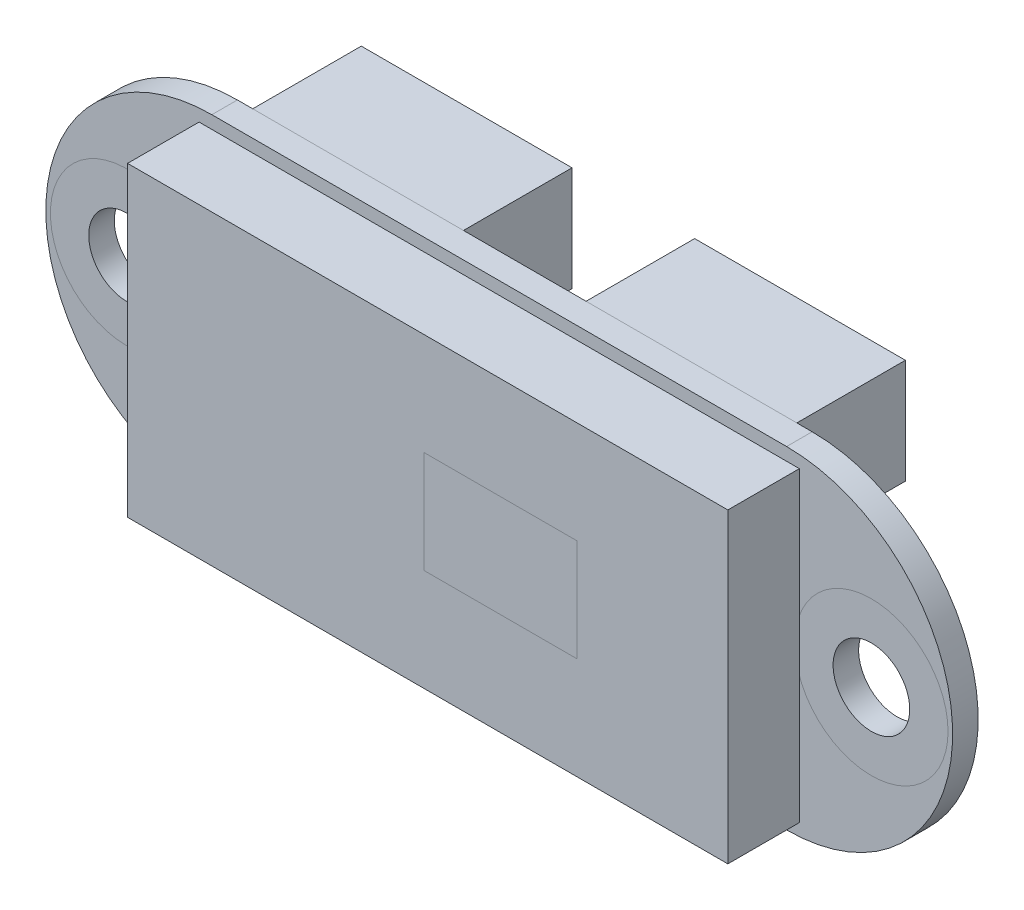
from build123d import *

# Parameters (mm, degrees)
SKETCH_1_R        = 3
EXTRUDE_1_DEPTH   = 1
SKETCH_2_R        = 3
SKETCH_2_R_2      = 1.5
EXTRUDE_2_DEPTH   = 1
EXTRUDE_2_2_DEPTH = 1
SKETCH_3_W        = 23.5
SKETCH_3_H        = 12
SKETCH_3_W_2      = 6
SKETCH_3_H_2      = 4
EXTRUDE_3_DEPTH   = 2.8
SKETCH_4_W        = 6
SKETCH_4_H        = 4
EXTRUDE_4_DEPTH   = 2.8
SKETCH_5_W        = 8.25
SKETCH_5_H        = 4.1
EXTRUDE_5_DEPTH   = 4.25
EXTRUDE_5_2_DEPTH = 4.25


with BuildPart() as part:
    # 草图1 → 凸台-拉伸1 (new body)
    with BuildSketch(Plane.XY):
        with BuildLine():
            Line((-49.510803888, 21.866656957), (-27.010803888, 21.866656957))
            ThreePointArc((-27.010803888, 21.866656957), (-20.510803888, 15.366656957), (-27.010803888, 8.866656957))
            Line((-27.010803888, 8.866656957), (-49.510803888, 8.866656957))
            ThreePointArc((-49.510803888, 8.866656957), (-56.010803888, 15.366656957), (-49.510803888, 21.866656957))
        make_face()
        with Locations((-52.830803888, 15.366656957)):
            Circle(SKETCH_1_R, mode=Mode.SUBTRACT)
        with Locations((-23.690803888, 15.366656957)):
            Circle(SKETCH_1_R, mode=Mode.SUBTRACT)
    extrude(amount=EXTRUDE_1_DEPTH)


with BuildPart() as body_2:
    # 草图2 → 凸台-拉伸2 (new body)
    with BuildSketch(Plane.XY.offset(1)):
        with Locations((-23.690803888, 15.366656957)):
            Circle(SKETCH_2_R)
        with Locations((-23.690803888, 15.366656957)):
            Circle(SKETCH_2_R_2, mode=Mode.SUBTRACT)
    extrude(amount=-EXTRUDE_2_DEPTH)


with BuildPart() as body_3:
    # 草图2 → Extrude 2 2 (new body)
    with BuildSketch(Plane.XY.offset(1)):
        with Locations((-52.830803888, 15.366656957)):
            Circle(SKETCH_2_R)
        with Locations((-52.830803888, 15.366656957)):
            Circle(SKETCH_2_R_2, mode=Mode.SUBTRACT)
    extrude(amount=-EXTRUDE_2_2_DEPTH)


with BuildPart() as body_4:
    # 草图3 → 凸台-拉伸3 (new body)
    with BuildSketch(Plane.XY.offset(1)):
        with Locations((-38.260803888, 15.366656957)):
            Rectangle(SKETCH_3_W, SKETCH_3_H)
        with Locations((-35.410803888, 15.366656957)):
            Rectangle(SKETCH_3_W_2, SKETCH_3_H_2, mode=Mode.SUBTRACT)
    extrude(amount=EXTRUDE_3_DEPTH)


with BuildPart() as body_5:
    # 草图4 → 凸台-拉伸4 (new body)
    with BuildSketch(Plane.XY.offset(3.8)):
        with Locations((-35.410803888, 15.366656957)):
            Rectangle(SKETCH_4_W, SKETCH_4_H)
    extrude(amount=-EXTRUDE_4_DEPTH)


with BuildPart() as body_6:
    # 草图5 → 凸台-拉伸5 (new body)
    with BuildSketch(Plane(origin=(0, 0, 0), x_dir=(-1, 0, 0), z_dir=(0, 0, -1))):
        with Locations((31.735803888, 19.816656957)):
            Rectangle(SKETCH_5_W, SKETCH_5_H)
    extrude(amount=EXTRUDE_5_DEPTH)


with BuildPart() as body_7:
    # 草图5 → Extrude 5 2 (new body)
    with BuildSketch(Plane(origin=(0, 0, 0), x_dir=(-1, 0, 0), z_dir=(0, 0, -1))):
        with Locations((44.785803888, 19.816656957)):
            Rectangle(SKETCH_5_W, SKETCH_5_H)
    extrude(amount=EXTRUDE_5_2_DEPTH)


solid = Compound([part.part, body_2.part, body_3.part, body_4.part, body_5.part, body_6.part, body_7.part])
